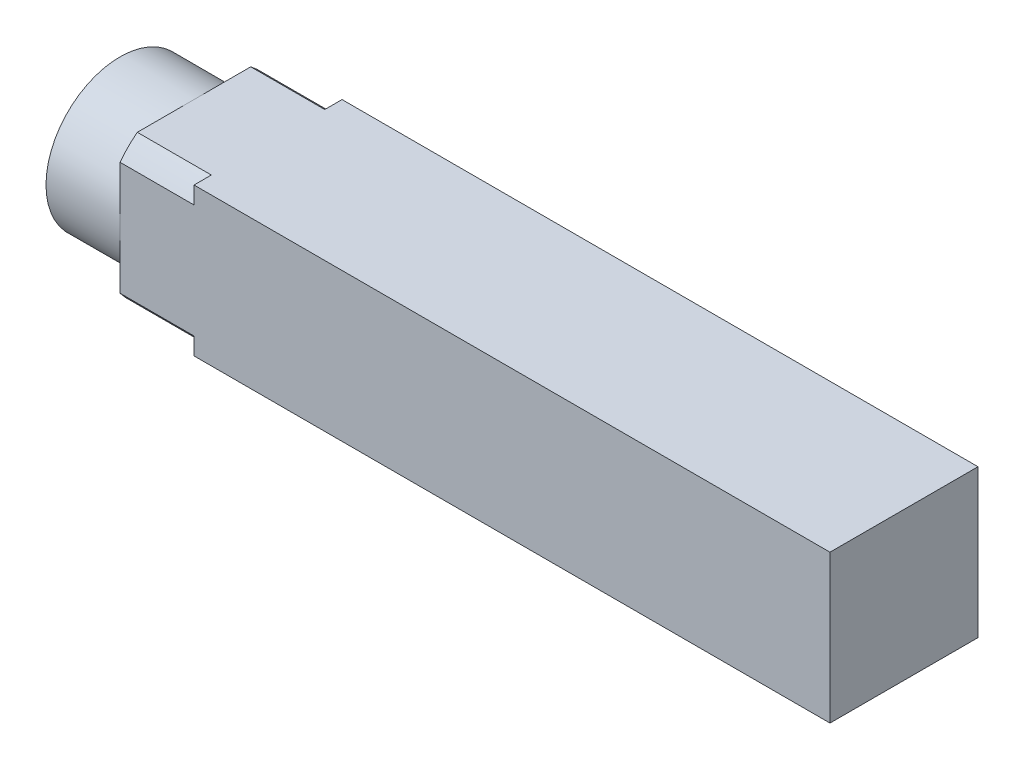
from build123d import *

# Parameters (mm, degrees)
SKETCH1_W           = 6.35
SKETCH1_H           = 6.35
BOSS_EXTRUDE1_DEPTH = 33.63214
SKETCH3_W           = 9.525
SKETCH3_H           = 9.525
SKETCH3_R           = 3.175
CUT_EXTRUDE2_DEPTH  = 3.175
SKETCH4_W           = 7.9375
SKETCH4_H           = 7.9375
CUT_EXTRUDE3_DEPTH  = 3.175


with BuildPart() as part:
    # Sketch1 → Boss-Extrude1 (new body)
    with BuildSketch(Plane(origin=(0, 0, 0), x_dir=(0, 0, -1), z_dir=(1, 0, 0))):
        Rectangle(SKETCH1_W, SKETCH1_H)
    extrude(amount=BOSS_EXTRUDE1_DEPTH)

    # Sketch3 → Cut-Extrude2 (cut)
    with BuildSketch(Plane.ZY):
        Rectangle(SKETCH3_W, SKETCH3_H)
        Circle(SKETCH3_R, mode=Mode.SUBTRACT)
    extrude(amount=-CUT_EXTRUDE2_DEPTH, mode=Mode.SUBTRACT)

    # Sketch4 → Cut-Extrude3 (cut)
    with BuildSketch(Plane(origin=(3.175, 0, 0), x_dir=(0, 0, -1), z_dir=(1, 0, 0))):
        Rectangle(SKETCH4_W, SKETCH4_H)
        with BuildLine():
            Line((3.175, -2.432976572), (3.175, 2.432976572))
            ThreePointArc((3.175, 2.432976572), (2.828427125, 2.828427125), (2.432976572, 3.175))
            Line((2.432976572, 3.175), (-2.432976572, 3.175))
            ThreePointArc((-2.432976572, 3.175), (-2.828427125, 2.828427125), (-3.175, 2.432976572))
            Line((-3.175, 2.432976572), (-3.175, -2.432976572))
            ThreePointArc((-3.175, -2.432976572), (-2.828427125, -2.828427125), (-2.432976572, -3.175))
            Line((-2.432976572, -3.175), (2.432976572, -3.175))
            ThreePointArc((2.432976572, -3.175), (2.828427125, -2.828427125), (3.175, -2.432976572))
        make_face(mode=Mode.SUBTRACT)
    extrude(amount=CUT_EXTRUDE3_DEPTH, mode=Mode.SUBTRACT)


solid = part.part
